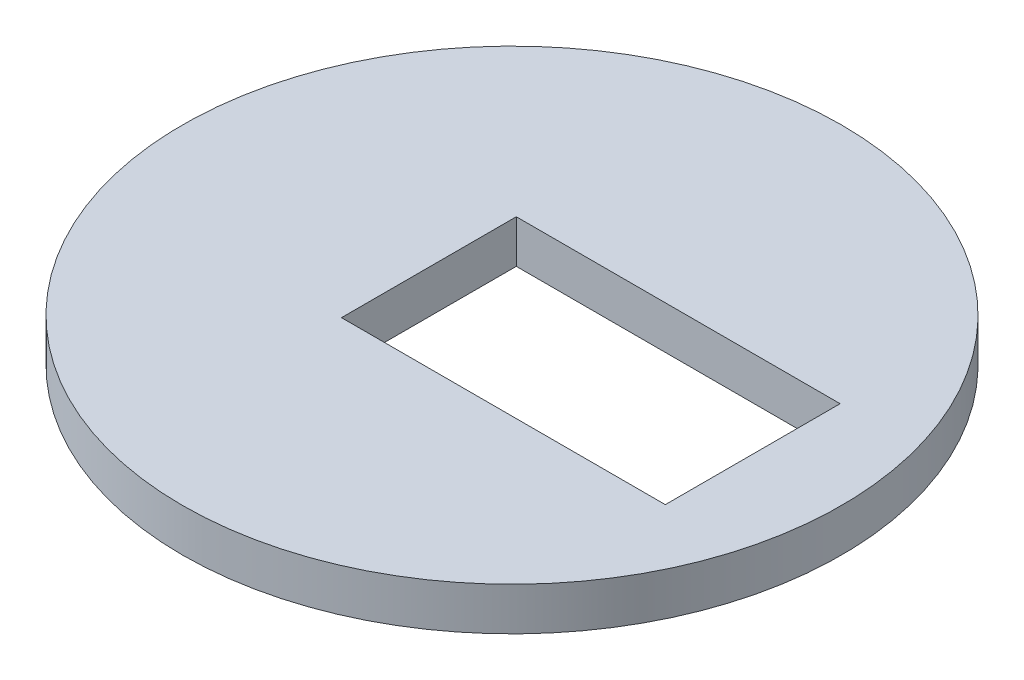
from build123d import *

# Parameters (mm, degrees)
SKETCH1_R           = 23
BOSS_EXTRUDE1_DEPTH = 3
SKETCH2_W           = 5.8
SKETCH2_H           = 6.1
SKETCH2_W_2         = 16.8
CUT_EXTRUDE1_DEPTH  = 10


with BuildPart() as part:
    # Sketch1 → Boss-Extrude1 (new body)
    with BuildSketch(Plane(origin=(0, 0, 0), x_dir=(1, 0, 0), z_dir=(0, 1, 0))):
        with Locations(Location((0, 0, 0), (0, 0, 270))):
            Circle(SKETCH1_R)
    extrude(amount=BOSS_EXTRUDE1_DEPTH)

    # Sketch2 → Cut-Extrude1 (cut)
    with BuildSketch(Plane(origin=(0, 3, 0), x_dir=(1, 0, 0), z_dir=(0, 1, 0))):
        with Locations((-2.9, 3.05)):
            Rectangle(SKETCH2_W, SKETCH2_H)
        with Locations((8.4, 3.05)):
            Rectangle(SKETCH2_W_2, SKETCH2_H)
        with Locations((8.4, -3.05)):
            Rectangle(SKETCH2_W_2, SKETCH2_H)
        with Locations((-2.9, -3.05)):
            Rectangle(SKETCH2_W, SKETCH2_H)
    extrude(amount=-CUT_EXTRUDE1_DEPTH, mode=Mode.SUBTRACT)


solid = part.part
